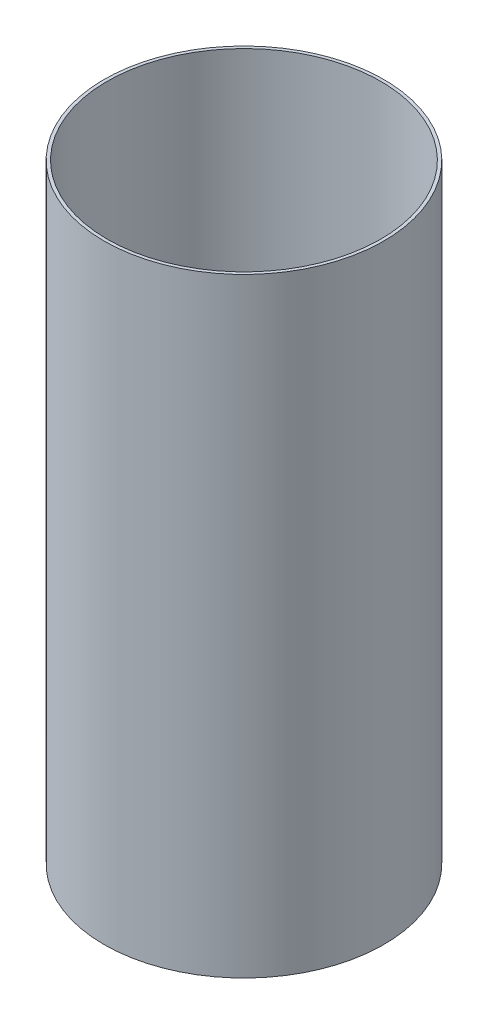
from build123d import *

# Parameters (mm, degrees)
SKETCH1_R        = 22.5
SKETCH1_R_2      = 22
EXTRUSION1_DEPTH = 98


with BuildPart() as part:
    # Sketch1 → Extrusion1 (new body)
    with BuildSketch(Plane(origin=(0, 0, 0), x_dir=(-1, 0, 0), z_dir=(0, 1, 0))):
        with Locations(Location((0, 0, 0), (0, 0, 90))):
            Circle(SKETCH1_R)
        with Locations(Location((0, 0, 0), (0, 0, 90))):
            Circle(SKETCH1_R_2, mode=Mode.SUBTRACT)
    extrude(amount=EXTRUSION1_DEPTH)


solid = part.part
